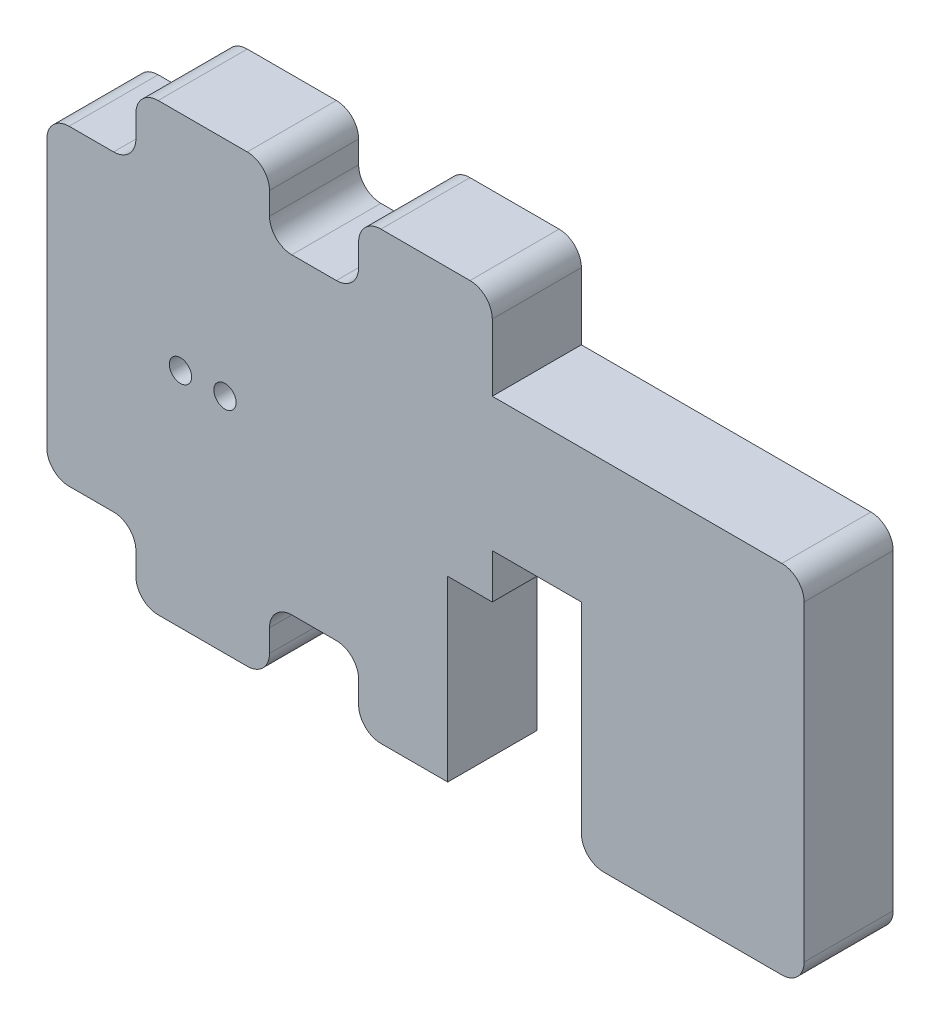
from build123d import *

# Parameters (mm, degrees)
SKETCH1_W               = 38.1
SKETCH1_H               = 25.4
BOSS_EXTRUDE1_DEPTH     = 5.08
CUT_EXTRUDE1_DEPTH      = 47.071427154
CUT_EXTRUDE1_DEPTH_BACK = 47.071427154
SKETCH2_R               = 0.635
SKETCH3_W               = 5.08
SKETCH3_H               = 3.81
CUT_EXTRUDE2_DEPTH      = 47.071427154
SKETCH4_W               = 2.54
SKETCH4_H               = 12.7
CUT_EXTRUDE3_DEPTH      = 47.071427154
BOSS_EXTRUDE2_DEPTH     = 5.08
SKETCH6_W               = 10.16
SKETCH6_H               = 25.4
CUT_EXTRUDE4_DEPTH      = 60.296897052
SKETCH7_W               = 2.54
SKETCH7_H               = 5.08
CUT_EXTRUDE5_DEPTH      = 60.296897052
FILLET1_R               = 1.27
SKETCH8_W               = 2.54
SKETCH8_H               = 10.16
CUT_EXTRUDE6_DEPTH      = 60.296897052
FILLET2_R               = 1.27


with BuildPart() as part:
    # Sketch1 → Boss-Extrude1 (new body)
    with BuildSketch(Plane.XY):
        with Locations((19.05, 12.7)):
            Rectangle(SKETCH1_W, SKETCH1_H)
    extrude(amount=BOSS_EXTRUDE1_DEPTH)

    # Sketch2 → Cut-Extrude1 (cut, two sides: drawn at the far end of the back side and taken through both)
    with BuildSketch(Plane.XY.offset(5.08).offset(-CUT_EXTRUDE1_DEPTH_BACK)):
        with Locations((17.78, 12.7)):
            Circle(SKETCH2_R)
        with Locations((20.32, 12.7)):
            Circle(SKETCH2_R)
    extrude(amount=CUT_EXTRUDE1_DEPTH + CUT_EXTRUDE1_DEPTH_BACK, mode=Mode.SUBTRACT)

    # Sketch3 → Cut-Extrude2 (cut, through all)
    with BuildSketch(Plane(origin=(0, 0, 0), x_dir=(-1, 0, 0), z_dir=(0, 0, -1))):
        with Locations((-25.4, 23.495)):
            Rectangle(SKETCH3_W, SKETCH3_H)
        with Locations((-12.7, 23.495)):
            Rectangle(SKETCH3_W, SKETCH3_H)
    cut_extrude2 = extrude(amount=-CUT_EXTRUDE2_DEPTH, mode=Mode.SUBTRACT)

    # Mirror1: Cut-Extrude2 across plane
    add(cut_extrude2.mirror(Plane.ZX.offset(12.7)), mode=Mode.SUBTRACT)

    # Sketch4 → Cut-Extrude3 (cut, through all)
    with BuildSketch(Plane.XY.offset(5.08)):
        with Locations((36.83, 6.35)):
            Rectangle(SKETCH4_W, SKETCH4_H)
    extrude(amount=-CUT_EXTRUDE3_DEPTH, mode=Mode.SUBTRACT)

    # Sketch5 → Boss-Extrude2 (add, through all)
    with BuildSketch(Plane.XY.offset(5.08)):
        Polygon((38.1, 20.32), (53.34, 20.32), (53.34, 0), (40.64, 0), (40.64, 12.7), (38.1, 12.7), align=None)
    extrude(amount=-BOSS_EXTRUDE2_DEPTH)

    # Sketch6 → Cut-Extrude4 (cut, through all)
    with BuildSketch(Plane.XY.offset(5.08)):
        with Locations((5.08, 12.7)):
            Rectangle(SKETCH6_W, SKETCH6_H)
    extrude(amount=-CUT_EXTRUDE4_DEPTH, mode=Mode.SUBTRACT)

    # Sketch7 → Cut-Extrude5 (cut, through all)
    with BuildSketch(Plane.XY.offset(5.08)):
        with Locations((36.83, 22.86)):
            Rectangle(SKETCH7_W, SKETCH7_H)
    extrude(amount=-CUT_EXTRUDE5_DEPTH, mode=Mode.SUBTRACT)

    # Fillet1
    fillet1_edges = [part.edges().sort_by_distance(p)[0] for p in [
        (35.56, 25.4, 2.54),
        (27.94, 21.59, 2.54),
        (27.94, 25.4, 2.54),
        (22.86, 25.4, 2.54),
        (22.86, 21.59, 2.54),
        (15.24, 21.59, 2.54),
        (15.24, 25.4, 2.54),
        (10.16, 21.59, 2.54),
        (27.94, 0, 2.54),
        (27.94, 3.81, 2.54),
        (22.86, 3.81, 2.54),
        (22.86, 0, 2.54),
        (15.24, 0, 2.54),
        (15.24, 3.81, 2.54),
        (10.16, 3.81, 2.54),
    ]]
    fillet(fillet1_edges, radius=FILLET1_R)

    # Sketch8 → Cut-Extrude6 (cut, through all)
    with BuildSketch(Plane.XY.offset(5.08)):
        with Locations((34.29, 5.08)):
            Rectangle(SKETCH8_W, SKETCH8_H)
    extrude(amount=-CUT_EXTRUDE6_DEPTH, mode=Mode.SUBTRACT)

    # Fillet2
    fillet2_edges = [part.edges().sort_by_distance(p)[0] for p in [
        (53.34, 20.32, 2.54),
        (53.34, 0, 2.54),
        (40.64, 0, 2.54),
    ]]
    fillet(fillet2_edges, radius=FILLET2_R)


solid = part.part
